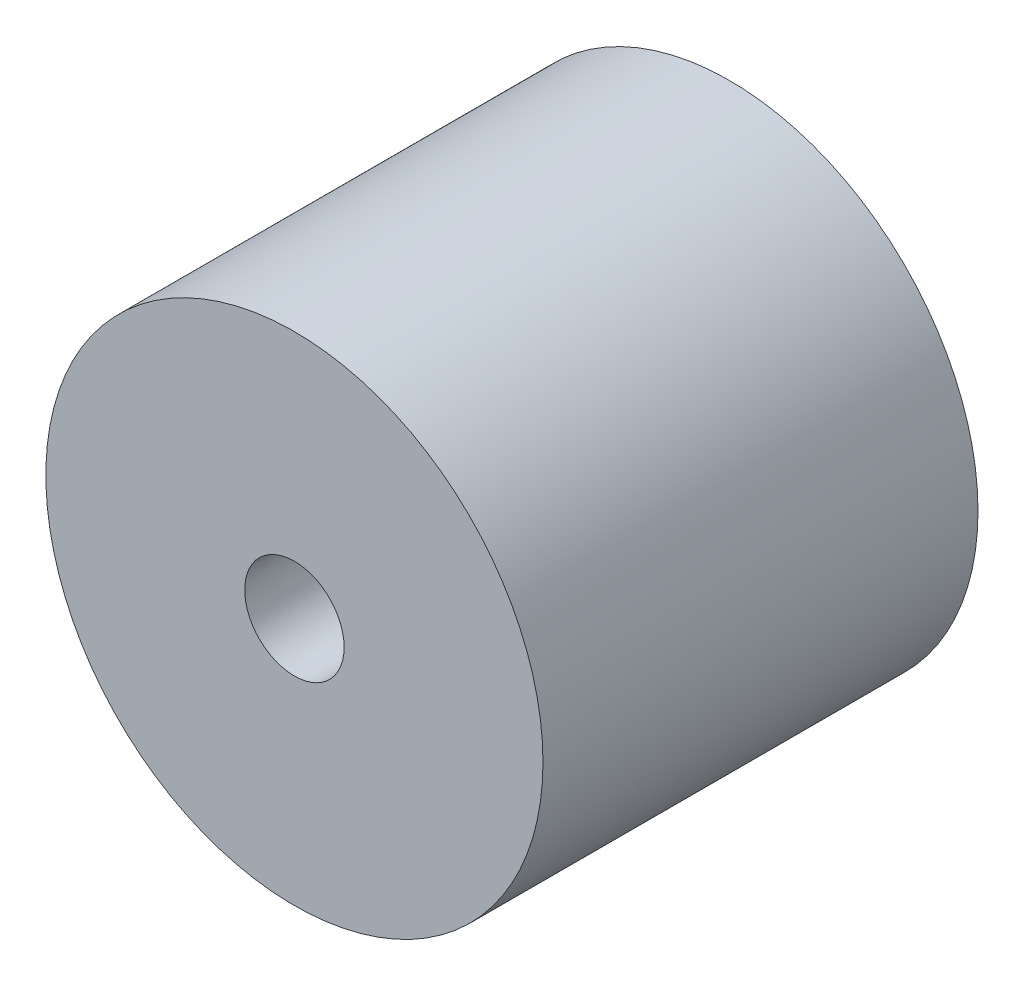
from build123d import *

# Parameters (mm, degrees)
SKETCH1_W = 3.5
SKETCH1_H = 1.6


with BuildPart() as part:
    # Sketch1 → Revolve1 (revolve)
    with BuildSketch(Plane(origin=(0, 0, 0), x_dir=(0, 0, -1), z_dir=(1, 0, 0)), mode=Mode.PRIVATE) as revolve1_sk:
        with Locations((1.75, 1.2)):
            Rectangle(SKETCH1_W, SKETCH1_H)
    revolve(revolve1_sk.sketch.rotate(Axis((0, 0, 110.940504922), (0, 0, -1)), 90), axis=Axis((0, 0, 110.940504922), (0, 0, -1)))


solid = part.part
